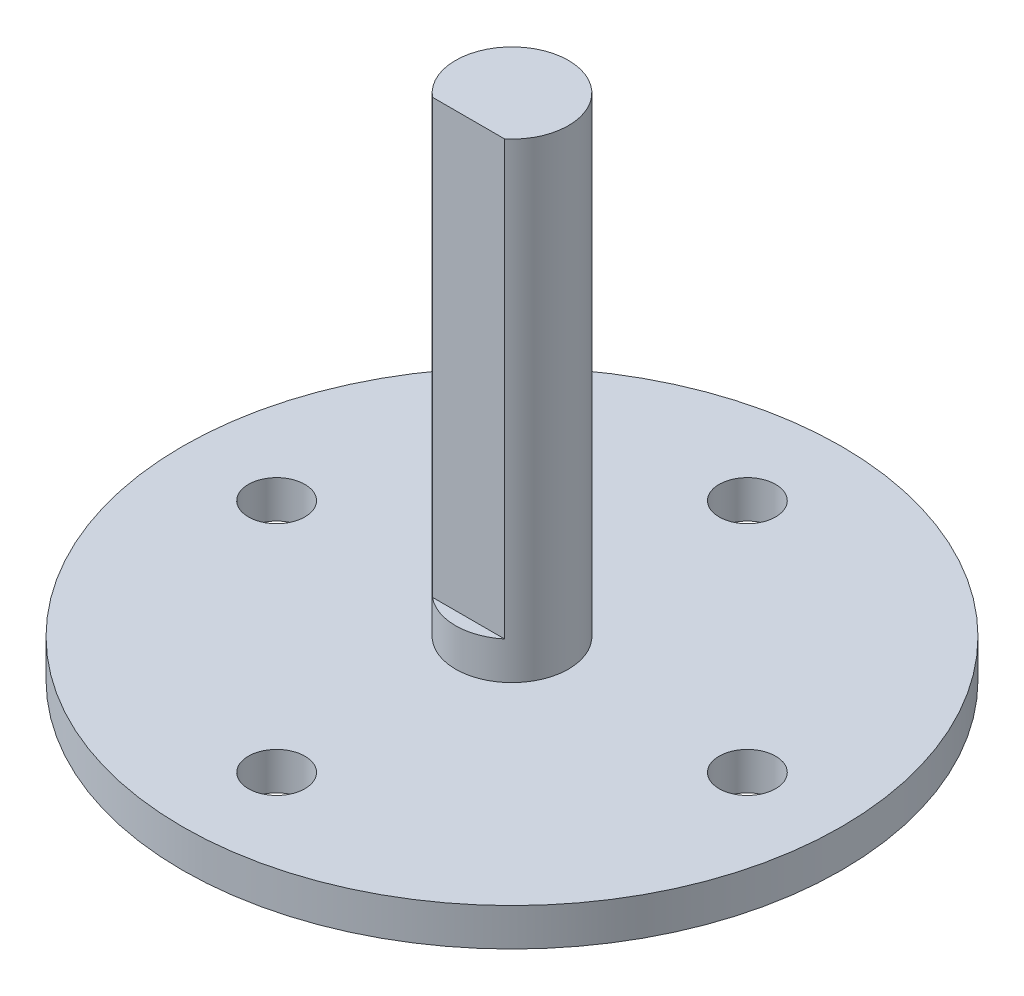
from build123d import *

# Parameters (mm, degrees)
SKETCH_1_R      = 17.5
SKETCH_1_R_2    = 1.5
EXTRUDE_1_DEPTH = 2
EXTRUDE_2_DEPTH = 25
SKETCH_3_R      = 3
EXTRUDE_3_DEPTH = 2


with BuildPart() as part:
    # 草图1 → 凸台-拉伸1 (new body)
    with BuildSketch(Plane(origin=(0, 0, 0), x_dir=(1, 0, 0), z_dir=(0, 1, 0))):
        with Locations(Location((0, 0, 0), (0, 0, 270))):
            Circle(SKETCH_1_R)
        with Locations(Location((0, 12.5, 0), (0, 0, 270))):
            Circle(SKETCH_1_R_2, mode=Mode.SUBTRACT)
        with Locations(Location((12.5, 0, 0), (0, 0, 270))):
            Circle(SKETCH_1_R_2, mode=Mode.SUBTRACT)
        with Locations(Location((0, -12.5, 0), (0, 0, 270))):
            Circle(SKETCH_1_R_2, mode=Mode.SUBTRACT)
        with Locations(Location((-12.5, 0, 0), (0, 0, 270))):
            Circle(SKETCH_1_R_2, mode=Mode.SUBTRACT)
    extrude(amount=EXTRUDE_1_DEPTH)

    # 草图2 → 凸台-拉伸2 (add)
    with BuildSketch(Plane(origin=(0, 2, 0), x_dir=(1, 0, 0), z_dir=(0, 1, 0))):
        with BuildLine():
            Line((-1.916694525, -2.307873934), (1.916694525, -2.307873934))
            ThreePointArc((1.916694525, -2.307873934), (0, 3), (-1.916694525, -2.307873934))
        make_face()
    extrude(amount=EXTRUDE_2_DEPTH)

    # 草图3 → 凸台-拉伸3 (add)
    with BuildSketch(Plane(origin=(0, 2, 0), x_dir=(1, 0, 0), z_dir=(0, 1, 0))):
        with Locations(Location((0, 0, 0), (0, 0, 309.709708175))):
            Circle(SKETCH_3_R)
    extrude(amount=EXTRUDE_3_DEPTH)


solid = part.part
